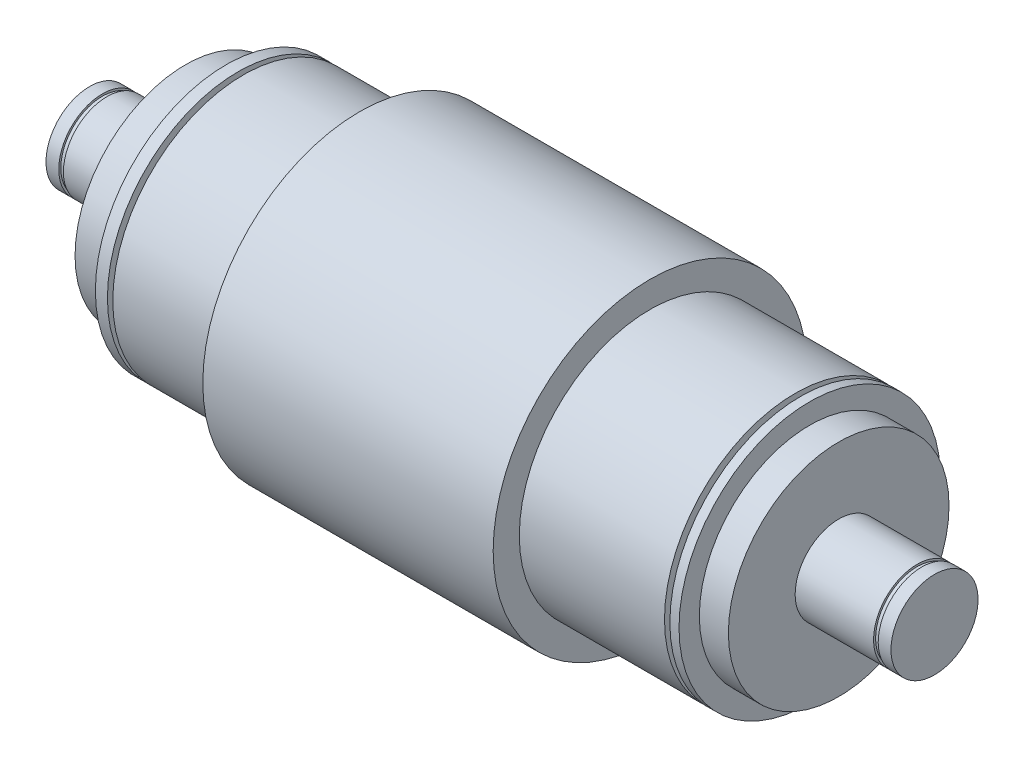
from build123d import *

# Parameters (mm, degrees)
SCHIZZO2_W   = 1.6
SCHIZZO2_H   = 0.7
SCHIZZO2_W_2 = 1.85
SCHIZZO2_H_2 = 23.75


with BuildPart() as part:
    # Schizzo1 → Rivoluzione1 (revolve)
    with BuildSketch(Plane.XY, mode=Mode.PRIVATE) as rivoluzione1_sk:
        Polygon((0, 0), (291, 0), (291, 15), (258, 15), (258, 38), (248, 38), (248, 45), (193, 45), (193, 54), (93, 54), (93, 45), (47, 45), (47, 38), (33, 38), (33, 15), (0, 15), align=None)
    revolve(rivoluzione1_sk.sketch.rotate(Axis((0, 0, 0), (1, 0, 0)), 90), axis=Axis((0, 0, 0), (1, 0, 0)))

    # Schizzo2 → Taglia-Rivoluzione1 (revolve, cut)
    with BuildSketch(Plane.XY, mode=Mode.PRIVATE) as taglia_rivoluzione1_sk:
        with Locations((5.2, 14.65)):
            Rectangle(SCHIZZO2_W, SCHIZZO2_H)
        with Locations((52.075, 33.125)):
            Rectangle(SCHIZZO2_W_2, SCHIZZO2_H_2)
        with Locations((243.925, 33.125)):
            Rectangle(SCHIZZO2_W_2, SCHIZZO2_H_2)
        with Locations((285.8, 14.65)):
            Rectangle(SCHIZZO2_W, SCHIZZO2_H)
    revolve(taglia_rivoluzione1_sk.sketch.rotate(Axis((0, 0, 0), (1, 0, 0)), 90), axis=Axis((0, 0, 0), (1, 0, 0)), mode=Mode.SUBTRACT)


solid = part.part
